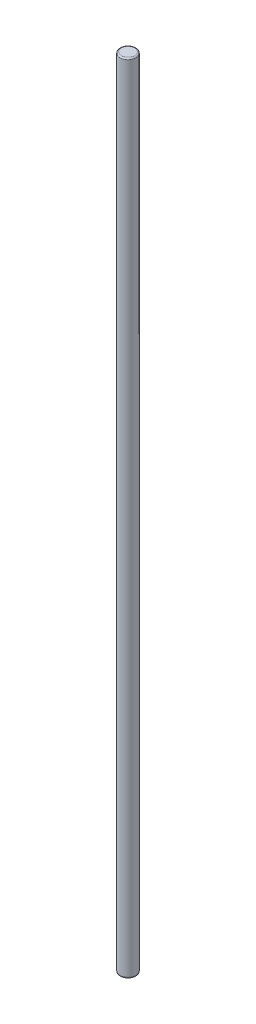
from build123d import *

# Parameters (mm, degrees)
SKETCH1_R           = 6
BOSS_EXTRUDE1_DEPTH = 600
FILLET1_R           = 1


with BuildPart() as part:
    # Sketch1 → Boss-Extrude1 (new body)
    with BuildSketch(Plane(origin=(0, 0, 0), x_dir=(1, 0, 0), z_dir=(0, 1, 0))):
        with Locations(Location((0, 0, 0), (0, 0, 270))):
            Circle(SKETCH1_R)
    extrude(amount=BOSS_EXTRUDE1_DEPTH)

    # Fillet1
    fillet1_edges = [part.edges().sort_by_distance(p)[0] for p in [
        (0, 0, -6),
        (0, 600, -6),
    ]]
    fillet(fillet1_edges, radius=FILLET1_R)


solid = part.part
